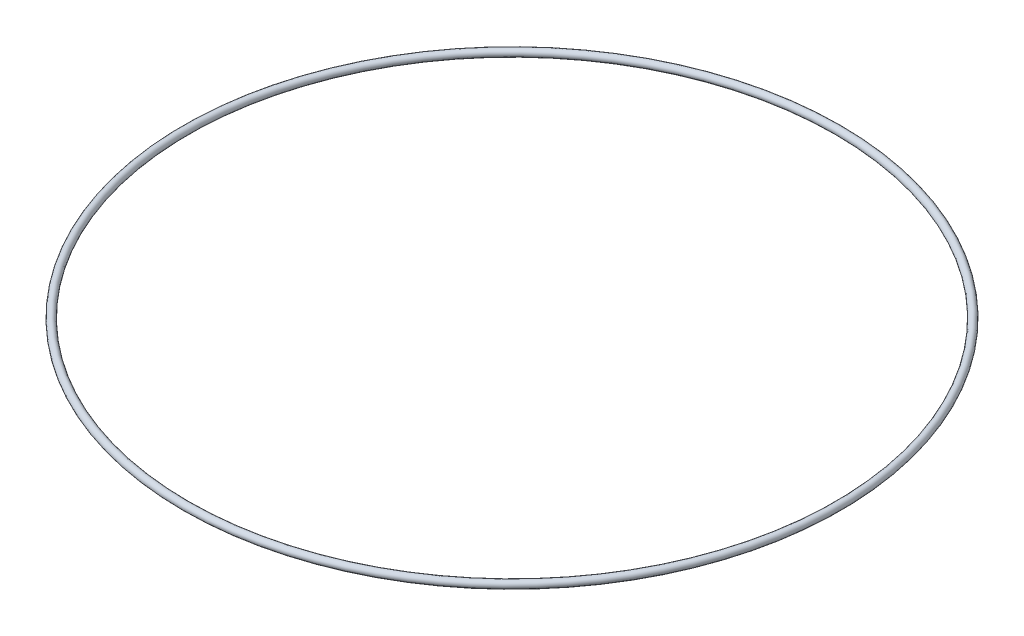
from build123d import *

# Parameters (mm, degrees)
SKETCH2_R = 2.5


with BuildPart() as part:
    # Sketch2 → Revolve1 (revolve)
    with BuildSketch(Plane(origin=(0, 0, 0), x_dir=(0, 0, -1), z_dir=(1, 0, 0))):
        with Locations((220, 0)):
            Circle(SKETCH2_R)
    revolve(axis=Axis((0, 0, 0), (0, 1, 0)))


solid = part.part
